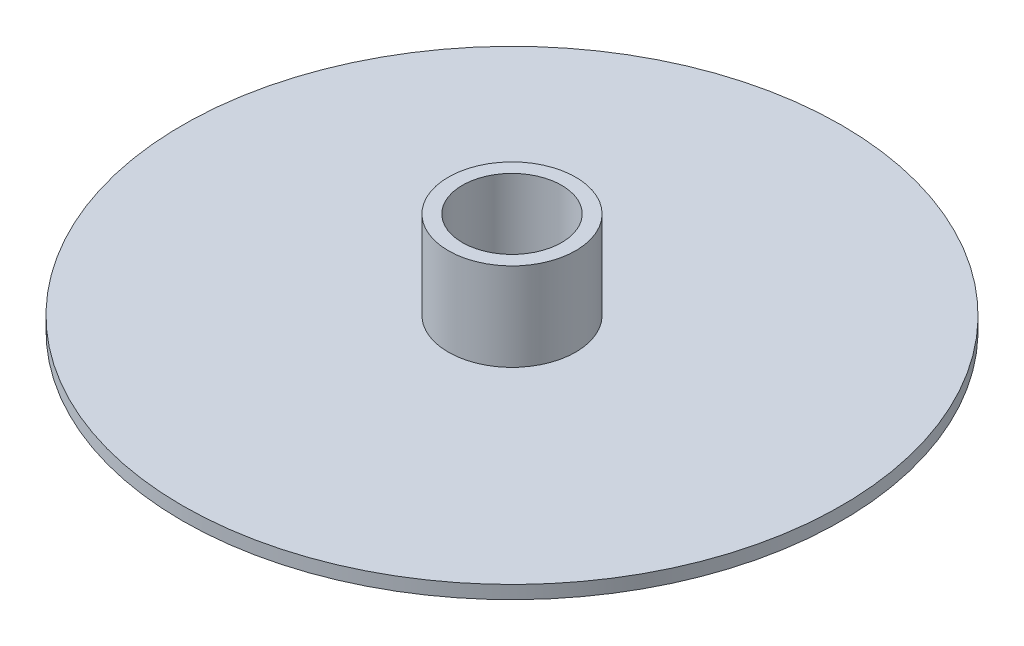
from build123d import *

# Parameters (mm, degrees)
SKETCH1_R           = 75
BOSS_EXTRUDE1_DEPTH = 3
SKETCH2_R           = 14.5
SKETCH2_R_2         = 11.3
BOSS_EXTRUDE2_DEPTH = 20
FILLET1_R           = 3


with BuildPart() as part:
    # Sketch1 → Boss-Extrude1 (new body)
    with BuildSketch(Plane(origin=(0, 0, 0), x_dir=(1, 0, 0), z_dir=(0, 1, 0))):
        with Locations(Location((0, 0, 0), (0, 0, 270))):
            Circle(SKETCH1_R)
    extrude(amount=BOSS_EXTRUDE1_DEPTH)

    # Sketch2 → Boss-Extrude2 (add)
    with BuildSketch(Plane(origin=(0, 3, 0), x_dir=(1, 0, 0), z_dir=(0, 1, 0))):
        with Locations(Location((0, 0, 0), (0, 0, 270))):
            Circle(SKETCH2_R)
        with Locations(Location((0, 0, 0), (0, 0, 270))):
            Circle(SKETCH2_R_2, mode=Mode.SUBTRACT)
    extrude(amount=BOSS_EXTRUDE2_DEPTH)

    # Fillet1
    fillet1_edges = [part.edges().sort_by_distance(p)[0] for p in [
        (0, 3, -11.3),
    ]]
    fillet(fillet1_edges, radius=FILLET1_R)


solid = part.part
